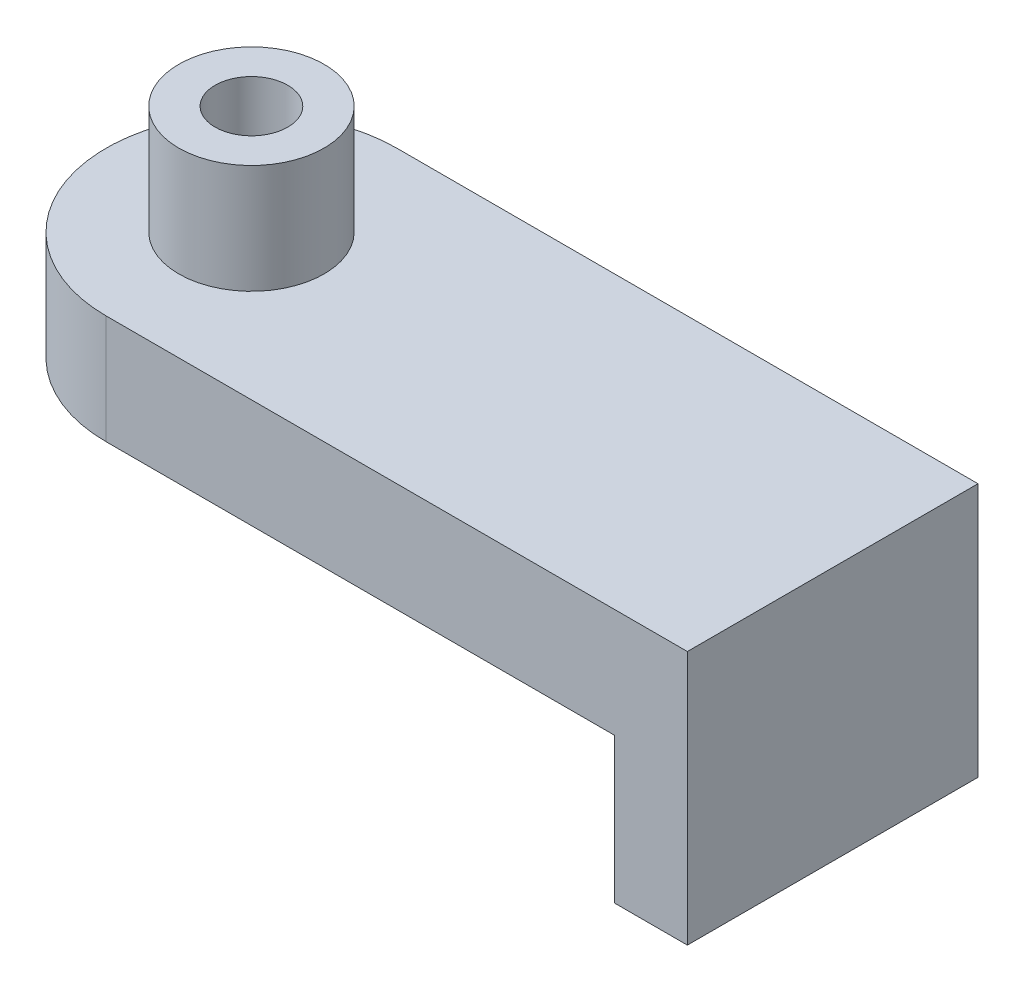
from build123d import *

# Parameters (mm, degrees)
CROQUIS2_R              = 5
SALIENTE_EXTRUIR1_DEPTH = 15
CROQUIS3_R              = 10
CROQUIS3_R_2            = 5
SALIENTE_EXTRUIR2_DEPTH = 15
CROQUIS4_W              = 10
CROQUIS4_H              = 40
SALIENTE_EXTRUIR3_DEPTH = 20


with BuildPart() as part:
    # Croquis2 → Saliente-Extruir1 (new body)
    with BuildSketch(Plane(origin=(0, 0, 0), x_dir=(1, 0, 0), z_dir=(0, 1, 0))):
        with BuildLine():
            Line((-40, 20), (40, 20))
            Line((40, 20), (40, -20))
            Line((40, -20), (-40, -20))
            ThreePointArc((-40, -20), (-60, 0), (-40, 20))
        make_face()
        with Locations(Location((-40, 0, 0), (0, 0, 270))):
            Circle(CROQUIS2_R, mode=Mode.SUBTRACT)
    extrude(amount=SALIENTE_EXTRUIR1_DEPTH)

    # Croquis3 → Saliente-Extruir2 (add)
    with BuildSketch(Plane(origin=(0, 15, 0), x_dir=(1, 0, 0), z_dir=(0, 1, 0))):
        with Locations(Location((-40, 0, 0), (0, 0, 270))):
            Circle(CROQUIS3_R)
        with Locations(Location((-40, 0, 0), (0, 0, 270))):
            Circle(CROQUIS3_R_2, mode=Mode.SUBTRACT)
    extrude(amount=SALIENTE_EXTRUIR2_DEPTH)

    # Croquis4 → Saliente-Extruir3 (add)
    with BuildSketch(Plane.XZ):
        with Locations((35, 0)):
            Rectangle(CROQUIS4_W, CROQUIS4_H)
    extrude(amount=SALIENTE_EXTRUIR3_DEPTH)


solid = part.part
